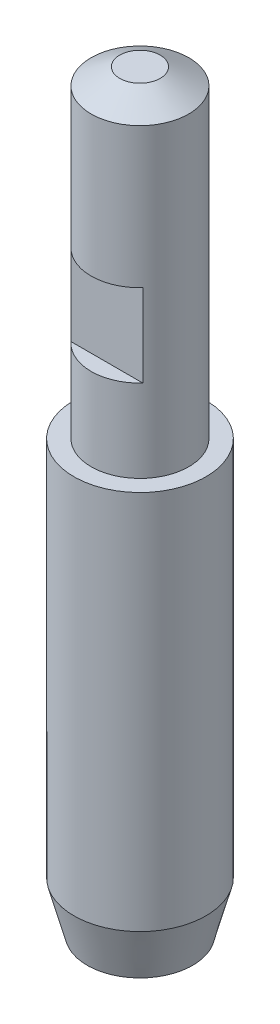
from build123d import *

# Parameters (mm, degrees)
ESQUISSE4_R             = 1.6
ENL_V_MAT_EXTRU_1_DEPTH = 10
ESQUISSE7_W             = 2.232279801
ESQUISSE7_H             = 5
ENL_V_MAT_EXTRU_3_DEPTH = 5


with BuildPart() as part:
    # Esquisse1 → Révolution1 (revolve)
    with BuildSketch(Plane.XY):
        Polygon((0, 30), (-3.196152423, 30), (-4, 33), (-4, 56.025303512), (-2.955946463, 56.025303512), (-2.955946463, 74.525303512), (-1.223895655, 75.525303512), (0, 75.525303512), align=None)
    revolve(axis=Axis((0, 77.095183619, 0), (0, -1, 0)))

    # Esquisse4 → Enlèv. mat.-Extru.1 (cut)
    with BuildSketch(Plane.XZ.offset(-30)):
        Circle(ESQUISSE4_R)
    extrude(amount=-ENL_V_MAT_EXTRU_1_DEPTH, mode=Mode.SUBTRACT)

    # Esquisse7 → Enlèv. mat.-Extru.3 (cut, symmetric)
    with BuildSketch(Plane(origin=(0, 0, 0), x_dir=(0, 0, -1), z_dir=(1, 0, 0))):
        with Locations((-3.116139901, 63.525303512)):
            Rectangle(ESQUISSE7_W, ESQUISSE7_H)
        with Locations((3.116139901, 63.525303512)):
            Rectangle(ESQUISSE7_W, ESQUISSE7_H)
    extrude(amount=ENL_V_MAT_EXTRU_3_DEPTH, both=True, mode=Mode.SUBTRACT)


solid = part.part
